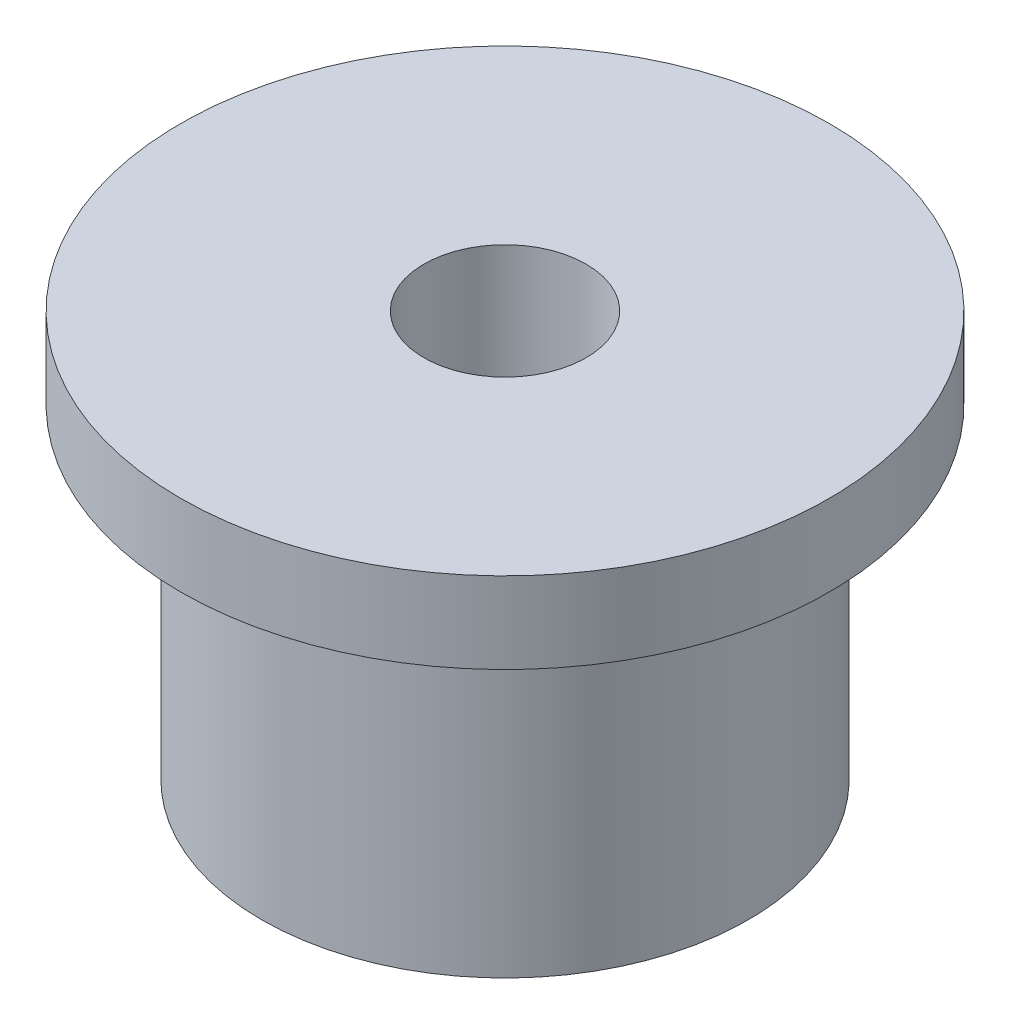
from build123d import *

# Parameters (mm, degrees)
SKETCH1_R           = 100
BOSS_EXTRUDE1_DEPTH = 25
SKETCH3_R           = 75
BOSS_EXTRUDE2_DEPTH = 100
SKETCH4_R           = 25
CUT_EXTRUDE1_DEPTH  = 189.745860882


with BuildPart() as part:
    # Sketch1 → Boss-Extrude1 (new body)
    with BuildSketch(Plane(origin=(0, 0, 0), x_dir=(1, 0, 0), z_dir=(0, 1, 0))):
        with Locations(Location((0, 0, 0), (0, 0, 270))):
            Circle(SKETCH1_R)
    extrude(amount=BOSS_EXTRUDE1_DEPTH)

    # Sketch3 → Boss-Extrude2 (add)
    with BuildSketch(Plane.XZ):
        with Locations(Location((0, 0, 0), (0, 0, 270))):
            Circle(SKETCH3_R)
    extrude(amount=BOSS_EXTRUDE2_DEPTH)

    # Sketch4 → Cut-Extrude1 (cut, through all)
    with BuildSketch(Plane.XZ.offset(100)):
        with Locations(Location((0, 0, 0), (0, 0, 270))):
            Circle(SKETCH4_R)
    extrude(amount=-CUT_EXTRUDE1_DEPTH, mode=Mode.SUBTRACT)


solid = part.part
